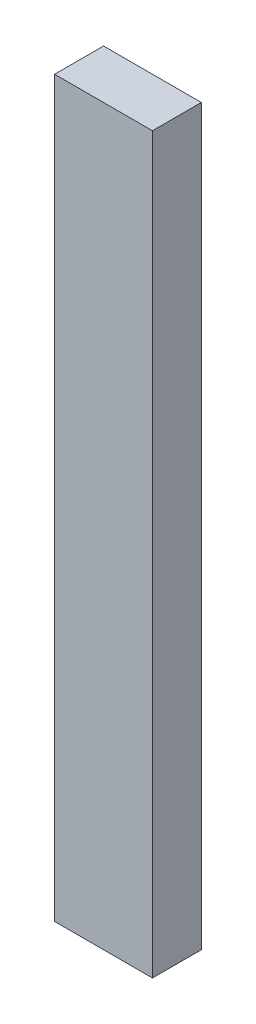
from build123d import *

# Parameters (mm, degrees)
ESQUISSE1_W        = 20
ESQUISSE1_H        = 150
BOSS_EXTRU_1_DEPTH = 5
ESQUISSE2_W        = 20
ESQUISSE2_H        = 150
BOSS_EXTRU_2_DEPTH = 5


with BuildPart() as part:
    # Esquisse1 → Boss.-Extru.1 (new body)
    with BuildSketch(Plane.XY):
        with Locations((-41.945195284, -26.747319263)):
            Rectangle(ESQUISSE1_W, ESQUISSE1_H)
        with BuildLine():
            Line((-45.495195284, 38.252680737), (-44.945195284, 22.252680737))
            ThreePointArc((-44.945195284, 22.252680737), (-41.945195284, 19.252680737), (-38.945195284, 22.252680737))
            Line((-38.945195284, 22.252680737), (-38.395195284, 38.252680737))
            ThreePointArc((-38.395195284, 38.252680737), (-41.945195284, 41.802680737), (-45.495195284, 38.252680737))
        make_face(mode=Mode.SUBTRACT)
    extrude(amount=BOSS_EXTRU_1_DEPTH)

    # Esquisse2 → Boss.-Extru.2 (add)
    with BuildSketch(Plane.XY.offset(5)):
        with Locations((-41.945195284, -26.747319263)):
            Rectangle(ESQUISSE2_W, ESQUISSE2_H)
    extrude(amount=BOSS_EXTRU_2_DEPTH)


solid = part.part
